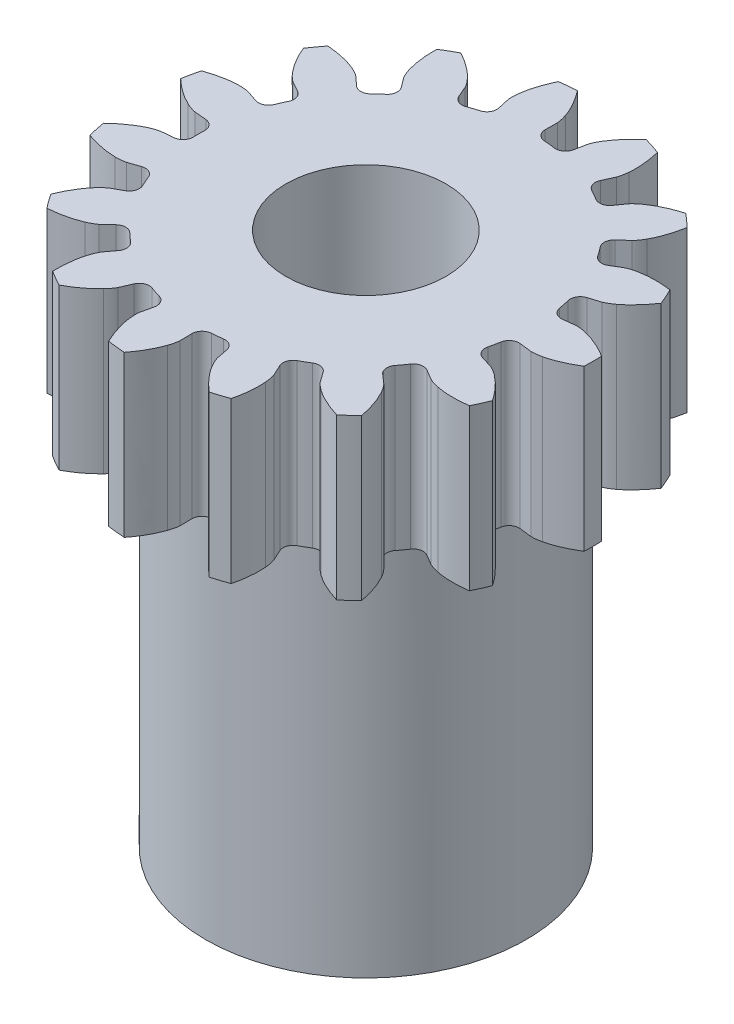
from build123d import *

# Parameters (mm, degrees)
GEAR_DEPTH          = 1.5
GEAR_DEPTH_BACK     = 1.5
SKETCH2_R           = 3
BOSS_EXTRUDE2_DEPTH = 7
CUT_EXTRUDE1_REACH  = 13.664
SKETCH3_R           = 1.5


with BuildPart() as part:
    # Sketch1 → Gear (new, two sides: drawn at the far end of the back side and taken through both)
    with BuildSketch(Plane(origin=(0, 0, 3), x_dir=(1, 0, 0), z_dir=(0, -1, 0)).offset(-GEAR_DEPTH_BACK)):
        with BuildLine():
            Line((3.283233276, -3.394638448), (3.506962679, -3.421139032))
            add(Edge.make_bspline(
                [(3.506962679, -3.421139032), (3.520971899, -3.421858666), (3.535034749, -3.421569149), (3.549044877, -3.420867398), (3.574923599, -3.419571163), (3.600737251, -3.416660714), (3.626357328, -3.412787712), (3.652179785, -3.408884116), (3.677858618, -3.40395475), (3.703347036, -3.39826459)],
                knots=[0, 0, 0, 0, 4.2083e-05, 4.2083e-05, 4.2083e-05, 0.000119856, 0.000119856, 0.000119856, 0.000198214, 0.000198214, 0.000198214, 0.000198214], degree=3))
            add(Edge.make_bspline(
                [(3.703347036, -3.39826459), (3.768488307, -3.383427383), (3.83255335, -3.363384186), (3.895049223, -3.339766527), (3.95623019, -3.31664578), (4.016141242, -3.289967313), (4.07458154, -3.260600474), (4.13359138, -3.230947433), (4.19124207, -3.198475681), (4.247452965, -3.163808703)],
                knots=[0, 0, 0, 0, 0.000200429, 0.000200429, 0.000200429, 0.00039651, 0.00039651, 0.00039651, 0.00059445, 0.00059445, 0.00059445, 0.00059445], degree=3))
            ThreePointArc((4.247452965, -3.163808703), (4.250611007, -2.999999723), (4.247452965, -2.836190743))
            add(Edge.make_bspline(
                [(4.247452965, -2.836190743), (4.190684784, -2.801180069), (4.132447355, -2.768407706), (4.072824237, -2.738516948), (4.014405475, -2.709229967), (3.954518093, -2.68263313), (3.893364025, -2.659597097), (3.831403647, -2.636257336), (3.767904147, -2.616439009), (3.703347036, -2.601734856)],
                knots=[0, 0, 0, 0, 0.000200088, 0.000200088, 0.000200088, 0.000396183, 0.000396183, 0.000396183, 0.000594989, 0.000594989, 0.000594989, 0.000594989], degree=3))
            add(Edge.make_bspline(
                [(3.703347036, -2.601734856), (3.67599376, -2.595628375), (3.648419071, -2.590394931), (3.620682813, -2.586371148), (3.601932002, -2.583650912), (3.583086418, -2.581476669), (3.564191122, -2.580076536), (3.545162836, -2.578666549), (3.526018009, -2.577881568), (3.506962679, -2.578860413)],
                knots=[0, 0, 0, 0, 8.408e-05, 8.408e-05, 8.408e-05, 0.000140907, 0.000140907, 0.000140907, 0.000198175, 0.000198175, 0.000198175, 0.000198175], degree=3))
            Line((3.506962679, -2.578860413), (3.28323342, -2.60536098))
            ThreePointArc((3.28323342, -2.60536098), (3.149457375, -2.56974365), (3.076583394, -2.452040481))
            ThreePointArc((3.076583394, -2.452040481), (3.056711251, -2.350275945), (3.033473976, -2.24922669))
            ThreePointArc((3.033473976, -2.24922669), (3.052173215, -2.112058995), (3.159896814, -2.025109088))
            Line((3.159896814, -2.025109088), (3.375062772, -1.958319562))
            add(Edge.make_bspline(
                [(3.375062772, -1.958319562), (3.388153533, -1.953278917), (3.400882829, -1.947294553), (3.413396289, -1.94095504), (3.436510452, -1.929245046), (3.45890861, -1.91608686), (3.480738424, -1.902128072), (3.502740676, -1.88805902), (3.524194504, -1.873111299), (3.545164935, -1.857546005)],
                knots=[0, 0, 0, 0, 4.2083e-05, 4.2083e-05, 4.2083e-05, 0.000119856, 0.000119856, 0.000119856, 0.000198214, 0.000198214, 0.000198214, 0.000198214], degree=3))
            add(Edge.make_bspline(
                [(3.545164935, -1.857546005), (3.598639612, -1.8174962), (3.649013638, -1.773128228), (3.696500292, -1.726133061), (3.742987831, -1.680126667), (3.786868191, -1.631386654), (3.828311489, -1.580788901), (3.870158683, -1.529698036), (3.909617758, -1.476584967), (3.946868635, -1.422052075)],
                knots=[0, 0, 0, 0, 0.000200429, 0.000200429, 0.000200429, 0.00039651, 0.00039651, 0.00039651, 0.00059445, 0.00059445, 0.00059445, 0.00059445], degree=3))
            ThreePointArc((3.946868635, -1.422052075), (3.883126535, -1.271120634), (3.813614406, -1.122758176))
            add(Edge.make_bspline(
                [(3.813614406, -1.122758176), (3.747513968, -1.113864033), (3.680981708, -1.107612287), (3.614355613, -1.104556627), (3.54907533, -1.10156269), (3.483547577, -1.101623663), (3.418310956, -1.1054528), (3.352214199, -1.109332423), (3.286143679, -1.117055054), (3.221187105, -1.129879885)],
                knots=[0, 0, 0, 0, 0.000200088, 0.000200088, 0.000200088, 0.000396183, 0.000396183, 0.000396183, 0.000594989, 0.000594989, 0.000594989, 0.000594989], degree=3))
            add(Edge.make_bspline(
                [(3.221187105, -1.129879885), (3.193714915, -1.135426917), (3.166395549, -1.141861564), (3.139420597, -1.149467008), (3.121184459, -1.15460859), (3.103083817, -1.16028751), (3.08525262, -1.166693835), (3.067295922, -1.173145248), (3.049486972, -1.180215035), (3.032477194, -1.188859756)],
                knots=[0, 0, 0, 0, 8.408e-05, 8.408e-05, 8.408e-05, 0.000140907, 0.000140907, 0.000140907, 0.000198175, 0.000198175, 0.000198175, 0.000198175], degree=3))
            Line((3.032477194, -1.188859756), (2.838868973, -1.30406819))
            ThreePointArc((2.838868973, -1.30406819), (2.702171593, -1.325941758), (2.587723707, -1.248055071))
            ThreePointArc((2.587723707, -1.248055071), (2.528178169, -1.163171167), (2.465849356, -1.080309431))
            ThreePointArc((2.465849356, -1.080309431), (2.427140833, -0.947394841), (2.490185524, -0.824147013))
            Line((2.490185524, -0.824147013), (2.65958366, -0.675615865))
            add(Edge.make_bspline(
                [(2.65958366, -0.675615865), (2.669492451, -0.665686515), (2.67868718, -0.655042056), (2.687540283, -0.644160939), (2.703893238, -0.62406195), (2.719003057, -0.602931197), (2.733268034, -0.581300225), (2.747645693, -0.559498385), (2.761164953, -0.537116903), (2.77399142, -0.514367857)],
                knots=[0, 0, 0, 0, 4.2083e-05, 4.2083e-05, 4.2083e-05, 0.000119856, 0.000119856, 0.000119856, 0.000198214, 0.000198214, 0.000198214, 0.000198214], degree=3))
            add(Edge.make_bspline(
                [(2.77399142, -0.514367857), (2.806553245, -0.456030429), (2.834526128, -0.395009308), (2.858792688, -0.332762524), (2.882548683, -0.271825406), (2.902811037, -0.209451439), (2.920091414, -0.146371583), (2.9375402, -0.082676969), (2.951984827, -0.018106313), (2.963834671, 0.046863258)],
                knots=[0, 0, 0, 0, 0.000200429, 0.000200429, 0.000200429, 0.00039651, 0.00039651, 0.00039651, 0.00059445, 0.00059445, 0.00059445, 0.00059445], degree=3))
            ThreePointArc((2.963834671, 0.046863258), (2.844214018, 0.158819743), (2.72036708, 0.266082462))
            add(Edge.make_bspline(
                [(2.72036708, 0.266082462), (2.656363751, 0.247322196), (2.593040693, 0.225972343), (2.530931878, 0.201664552), (2.470077628, 0.177847767), (2.410239846, 0.151139527), (2.352200678, 0.121107312), (2.293396271, 0.090679127), (2.236178925, 0.056750851), (2.18205447, 0.018614566)],
                knots=[0, 0, 0, 0, 0.000200088, 0.000200088, 0.000200088, 0.000396183, 0.000396183, 0.000396183, 0.000594989, 0.000594989, 0.000594989, 0.000594989], degree=3))
            add(Edge.make_bspline(
                [(2.18205447, 0.018614566), (2.159213557, 0.002373154), (2.136873281, -0.014616976), (2.115323849, -0.032536596), (2.100755578, -0.04465097), (2.086529644, -0.057201116), (2.072845721, -0.070306186), (2.059065488, -0.083503493), (2.045671744, -0.097205617), (2.033648663, -0.112021462)],
                knots=[0, 0, 0, 0, 8.408e-05, 8.408e-05, 8.408e-05, 0.000140907, 0.000140907, 0.000140907, 0.000198175, 0.000198175, 0.000198175, 0.000198175], degree=3))
            Line((2.033648663, -0.112021462), (1.903638244, -0.296017163))
            ThreePointArc((1.903638244, -0.296017163), (1.787655755, -0.371599494), (1.651423038, -0.346996614))
            ThreePointArc((1.651423038, -0.346996614), (1.562500089, -0.293670661), (1.47185698, -0.243324111))
            ThreePointArc((1.47185698, -0.243324111), (1.382433751, -0.137644766), (1.389898535, 0.000590313))
            Line((1.389898535, 0.000590313), (1.484238372, 0.205180698))
            add(Edge.make_bspline(
                [(1.484238372, 0.205180698), (1.489251871, 0.218281879), (1.493322184, 0.23174591), (1.496984147, 0.245287186), (1.503748319, 0.270299872), (1.508957174, 0.295749492), (1.51319077, 0.321312457), (1.517457807, 0.347077351), (1.520704898, 0.37302263), (1.523169588, 0.399021911)],
                knots=[0, 0, 0, 0, 4.2083e-05, 4.2083e-05, 4.2083e-05, 0.000119856, 0.000119856, 0.000119856, 0.000198214, 0.000198214, 0.000198214, 0.000198214], degree=3))
            add(Edge.make_bspline(
                [(1.523169588, 0.399021911), (1.529188326, 0.465559892), (1.5299233, 0.532683056), (1.526773858, 0.599418422), (1.52369068, 0.664749682), (1.516831483, 0.729972579), (1.506961004, 0.794627457), (1.49699433, 0.859912444), (1.483926902, 0.924775832), (1.468326768, 0.988948255)],
                knots=[0, 0, 0, 0, 0.000200429, 0.000200429, 0.000200429, 0.00039651, 0.00039651, 0.00039651, 0.00059445, 0.00059445, 0.00059445, 0.00059445], degree=3))
            ThreePointArc((1.468326768, 0.988948255), (1.313511059, 1.042571489), (1.156743572, 1.090187772))
            add(Edge.make_bspline(
                [(1.156743572, 1.090187772), (1.10590411, 1.047016917), (1.056739386, 1.001757047), (1.009887028, 0.954288845), (0.963981064, 0.907779475), (0.920179751, 0.859042065), (0.879373534, 0.807999615), (0.838029293, 0.756284178), (0.799558519, 0.702016764), (0.765624794, 0.645163136)],
                knots=[0, 0, 0, 0, 0.000200088, 0.000200088, 0.000200088, 0.000396183, 0.000396183, 0.000396183, 0.000594989, 0.000594989, 0.000594989, 0.000594989], degree=3))
            add(Edge.make_bspline(
                [(0.765624794, 0.645163136), (0.751364559, 0.621035631), (0.73786621, 0.596427766), (0.72546839, 0.571292435), (0.717086973, 0.554299954), (0.709195539, 0.537048616), (0.702024966, 0.519510786), (0.694803925, 0.501849521), (0.688141287, 0.483884281), (0.683183803, 0.465459105)],
                knots=[0, 0, 0, 0, 8.408e-05, 8.408e-05, 8.408e-05, 0.000140907, 0.000140907, 0.000140907, 0.000198175, 0.000198175, 0.000198175, 0.000198175], degree=3))
            Line((0.683183803, 0.465459105), (0.639251168, 0.244490667))
            ThreePointArc((0.639251168, 0.244490667), (0.564037996, 0.128268444), (0.429576324, 0.095333455))
            ThreePointArc((0.429576324, 0.095333455), (0.326651548, 0.107880915), (0.223367162, 0.117006903))
            ThreePointArc((0.223367162, 0.117006903), (0.098691314, 0.177178085), (0.049285462, 0.306498315))
            Line((0.049285462, 0.306498315), (0.052254785, 0.5317724))
            add(Edge.make_bspline(
                [(0.052254785, 0.5317724), (0.051506114, 0.545780099), (0.049748215, 0.559735648), (0.047585851, 0.573595674), (0.043591655, 0.599197137), (0.037998888, 0.624565154), (0.031469075, 0.649640043), (0.024887681, 0.674913005), (0.017301151, 0.699935907), (0.008977896, 0.724689913)],
                knots=[0, 0, 0, 0, 4.2083e-05, 4.2083e-05, 4.2083e-05, 0.000119856, 0.000119856, 0.000119856, 0.000198214, 0.000198214, 0.000198214, 0.000198214], degree=3))
            add(Edge.make_bspline(
                [(0.008977896, 0.724689913), (-0.012587148, 0.787923423), (-0.039217166, 0.849542426), (-0.069238043, 0.909227223), (-0.098627284, 0.967656258), (-0.131422014, 1.024450452), (-0.166736654, 1.079500937), (-0.20239546, 1.135087928), (-0.240715466, 1.18902858), (-0.281068174, 1.241307859)],
                knots=[0, 0, 0, 0, 0.000200429, 0.000200429, 0.000200429, 0.00039651, 0.00039651, 0.00039651, 0.00059445, 0.00059445, 0.00059445, 0.00059445], degree=3))
            ThreePointArc((-0.281068174, 1.241307859), (-0.444309896, 1.2273259), (-0.606891408, 1.207062457))
            add(Edge.make_bspline(
                [(-0.606891408, 1.207062457), (-0.635776399, 1.146945647), (-0.662281762, 1.085601603), (-0.685776463, 1.023180672), (-0.708796583, 0.962020611), (-0.728987784, 0.899681172), (-0.745505283, 0.836454191), (-0.762240563, 0.77239357), (-0.775312818, 0.707170347), (-0.783188364, 0.641429884)],
                knots=[0, 0, 0, 0, 0.000200088, 0.000200088, 0.000200088, 0.000396183, 0.000396183, 0.000396183, 0.000594989, 0.000594989, 0.000594989, 0.000594989], degree=3))
            add(Edge.make_bspline(
                [(-0.783188364, 0.641429884), (-0.786402197, 0.613588151), (-0.788724633, 0.585617475), (-0.789827144, 0.55761256), (-0.790572485, 0.538680126), (-0.790764917, 0.519710509), (-0.790182283, 0.50077237), (-0.789595549, 0.481700939), (-0.78837505, 0.462578936), (-0.785409743, 0.443730311)],
                knots=[0, 0, 0, 0, 8.408e-05, 8.408e-05, 8.408e-05, 0.000140907, 0.000140907, 0.000140907, 0.000198175, 0.000198175, 0.000198175, 0.000198175], degree=3))
            Line((-0.785409743, 0.443730311), (-0.735668241, 0.223996586))
            ThreePointArc((-0.735668241, 0.223996586), (-0.757107056, 0.087230348), (-0.866548039, 0.00245225))
            ThreePointArc((-0.866548039, 0.00245225), (-0.965678108, -0.027948384), (-1.063745058, -0.061620961))
            ThreePointArc((-1.063745058, -0.061620961), (-1.202115943, -0.057362093), (-1.299849716, 0.040682647))
            Line((-1.299849716, 0.040682647), (-1.388764239, 0.247688286))
            add(Edge.make_bspline(
                [(-1.388764239, 0.247688286), (-1.395145628, 0.260180444), (-1.402427783, 0.27221447), (-1.41004058, 0.283996721), (-1.424102514, 0.305760235), (-1.439529863, 0.326660289), (-1.455694019, 0.346911425), (-1.471985861, 0.367322531), (-1.489094234, 0.38709637), (-1.506766266, 0.406324907)],
                knots=[0, 0, 0, 0, 4.2083e-05, 4.2083e-05, 4.2083e-05, 0.000119856, 0.000119856, 0.000119856, 0.000198214, 0.000198214, 0.000198214, 0.000198214], degree=3))
            add(Edge.make_bspline(
                [(-1.506766266, 0.406324907), (-1.5521863, 0.4553203), (-1.601576738, 0.500780655), (-1.653278168, 0.543094839), (-1.703891805, 0.584518738), (-1.756951562, 0.623063997), (-1.811604139, 0.65899136), (-1.866789346, 0.69526886), (-1.923736053, 0.728959947), (-1.981863985, 0.76030652)],
                knots=[0, 0, 0, 0, 0.000200429, 0.000200429, 0.000200429, 0.00039651, 0.00039651, 0.00039651, 0.00059445, 0.00059445, 0.00059445, 0.00059445], degree=3))
            ThreePointArc((-1.981863985, 0.76030652), (-2.125305684, 0.681137114), (-2.26558935, 0.596497824))
            add(Edge.make_bspline(
                [(-2.26558935, 0.596497824), (-2.267525393, 0.5298298), (-2.266788377, 0.463008526), (-2.262862974, 0.396428012), (-2.259016862, 0.33119239), (-2.252106708, 0.266029977), (-2.241479463, 0.201550983), (-2.2307121, 0.136221842), (-2.216125525, 0.071320499), (-2.196581139, 0.008060323)],
                knots=[0, 0, 0, 0, 0.000200088, 0.000200088, 0.000200088, 0.000396183, 0.000396183, 0.000396183, 0.000594989, 0.000594989, 0.000594989, 0.000594989], degree=3))
            add(Edge.make_bspline(
                [(-2.196581139, 0.008060323), (-2.188192869, -0.018681549), (-2.17893782, -0.045178652), (-2.168554389, -0.071210847), (-2.161534778, -0.088809644), (-2.153994935, -0.10621752), (-2.145759838, -0.123281393), (-2.137466779, -0.140465366), (-2.128574179, -0.157437762), (-2.11819881, -0.17345074)],
                knots=[0, 0, 0, 0, 8.408e-05, 8.408e-05, 8.408e-05, 0.000140907, 0.000140907, 0.000140907, 0.000198175, 0.000198175, 0.000198175, 0.000198175], degree=3))
            Line((-2.11819881, -0.17345074), (-1.983383929, -0.353955795))
            ThreePointArc((-1.983383929, -0.353955795), (-1.94734142, -0.487617921), (-2.012838374, -0.609580226))
            ThreePointArc((-2.012838374, -0.609580226), (-2.091033147, -0.677672418), (-2.166925892, -0.74832127))
            ThreePointArc((-2.166925892, -0.74832127), (-2.295066223, -0.80071111), (-2.424228857, -0.75089469))
            Line((-2.424228857, -0.75089469), (-2.589653094, -0.597950423))
            add(Edge.make_bspline(
                [(-2.589653094, -0.597950423), (-2.600563801, -0.589133814), (-2.61211106, -0.581102103), (-2.62385797, -0.573434884), (-2.645556203, -0.559272429), (-2.668150606, -0.546454148), (-2.691154177, -0.534528369), (-2.71433946, -0.522508385), (-2.73801148, -0.511402686), (-2.761976636, -0.501024407)],
                knots=[0, 0, 0, 0, 4.2083e-05, 4.2083e-05, 4.2083e-05, 0.000119856, 0.000119856, 0.000119856, 0.000198214, 0.000198214, 0.000198214, 0.000198214], degree=3))
            add(Edge.make_bspline(
                [(-2.761976636, -0.501024407), (-2.823398123, -0.474738881), (-2.887008926, -0.45329768), (-2.951451262, -0.435670616), (-3.014537737, -0.418414422), (-3.078688006, -0.404782923), (-3.143228595, -0.39419085), (-3.208398179, -0.38349555), (-3.274124984, -0.375879523), (-3.339977292, -0.370885763)],
                knots=[0, 0, 0, 0, 0.000200429, 0.000200429, 0.000200429, 0.00039651, 0.00039651, 0.00039651, 0.00059445, 0.00059445, 0.00059445, 0.00059445], degree=3))
            ThreePointArc((-3.339977292, -0.370885763), (-3.438816706, -0.50155361), (-3.532546311, -0.635933956))
            add(Edge.make_bspline(
                [(-3.532546311, -0.635933956), (-3.507198646, -0.697625686), (-3.479346688, -0.758370186), (-3.448679919, -0.817597907), (-3.418632603, -0.875629259), (-3.385815922, -0.932347472), (-3.349881482, -0.986929474), (-3.313473251, -1.042231133), (-3.273749997, -1.095588566), (-3.23016508, -1.145430194)],
                knots=[0, 0, 0, 0, 0.000200088, 0.000200088, 0.000200088, 0.000396183, 0.000396183, 0.000396183, 0.000594989, 0.000594989, 0.000594989, 0.000594989], degree=3))
            add(Edge.make_bspline(
                [(-3.23016508, -1.145430194), (-3.211625115, -1.166448293), (-3.192392864, -1.186890234), (-3.17231888, -1.206448506), (-3.158748071, -1.219670673), (-3.144779661, -1.232506829), (-3.130316022, -1.244745937), (-3.115750585, -1.257071186), (-3.100723495, -1.268959296), (-3.084732059, -1.279367836)],
                knots=[0, 0, 0, 0, 8.408e-05, 8.408e-05, 8.408e-05, 0.000140907, 0.000140907, 0.000140907, 0.000198175, 0.000198175, 0.000198175, 0.000198175], degree=3))
            Line((-3.084732059, -1.279367836), (-2.888154516, -1.389433257))
            ThreePointArc((-2.888154516, -1.389433257), (-2.800862762, -1.496879876), (-2.811090668, -1.634937997))
            ThreePointArc((-2.811090668, -1.634937997), (-2.854829558, -1.728947989), (-2.895425554, -1.824357287))
            ThreePointArc((-2.895425554, -1.824357287), (-2.991178703, -1.924337156), (-3.129436804, -1.931362767))
            Line((-3.129436804, -1.931362767), (-3.342767402, -1.858925326))
            add(Edge.make_bspline(
                [(-3.342767402, -1.858925326), (-3.356320867, -1.855308737), (-3.370136604, -1.852668097), (-3.383986479, -1.850441643), (-3.409569191, -1.846329063), (-3.43542387, -1.843808952), (-3.461289329, -1.842270607), (-3.487359107, -1.840720109), (-3.513501668, -1.840202826), (-3.539616153, -1.840469303)],
                knots=[0, 0, 0, 0, 4.2083e-05, 4.2083e-05, 4.2083e-05, 0.000119856, 0.000119856, 0.000119856, 0.000198214, 0.000198214, 0.000198214, 0.000198214], degree=3))
            add(Edge.make_bspline(
                [(-3.539616153, -1.840469303), (-3.606418761, -1.84143865), (-3.673251043, -1.847723983), (-3.739291619, -1.857831917), (-3.803942709, -1.867727182), (-3.868091326, -1.881366452), (-3.931360272, -1.897941135), (-3.995245819, -1.914677349), (-4.058387961, -1.934453263), (-4.120578183, -1.956675783)],
                knots=[0, 0, 0, 0, 0.000200429, 0.000200429, 0.000200429, 0.00039651, 0.00039651, 0.00039651, 0.00059445, 0.00059445, 0.00059445, 0.00059445], degree=3))
            ThreePointArc((-4.120578183, -1.956675783), (-4.157725079, -2.116248413), (-4.188693923, -2.277134232))
            add(Edge.make_bspline(
                [(-4.188693923, -2.277134232), (-4.140445392, -2.323182608), (-4.090294348, -2.367347058), (-4.038188776, -2.408980975), (-3.98713571, -2.449773908), (-3.934086804, -2.488240827), (-3.879058559, -2.523488114), (-3.823304774, -2.559200132), (-3.765313352, -2.591787669), (-3.705224134, -2.619592679)],
                knots=[0, 0, 0, 0, 0.000200088, 0.000200088, 0.000200088, 0.000396183, 0.000396183, 0.000396183, 0.000594989, 0.000594989, 0.000594989, 0.000594989], degree=3))
            add(Edge.make_bspline(
                [(-3.705224134, -2.619592679), (-3.679738202, -2.631252785), (-3.65385418, -2.642104966), (-3.627560617, -2.651807511), (-3.609785126, -2.658366817), (-3.591803413, -2.664411765), (-3.573612129, -2.669709854), (-3.555292809, -2.675045233), (-3.536729549, -2.679793493), (-3.517887111, -2.682797864)],
                knots=[0, 0, 0, 0, 8.408e-05, 8.408e-05, 8.408e-05, 0.000140907, 0.000140907, 0.000140907, 0.000198175, 0.000198175, 0.000198175, 0.000198175], degree=3))
            Line((-3.517887111, -2.682797864), (-3.29353695, -2.70339234))
            ThreePointArc((-3.29353695, -2.70339234), (-3.170089487, -2.766044956), (-3.123279848, -2.896327389))
            ThreePointArc((-3.123279848, -2.896327389), (-3.125000003, -3.000000199), (-3.12327982, -3.103673008))
            ThreePointArc((-3.12327982, -3.103673008), (-3.17008919, -3.233955492), (-3.293536684, -3.296608352))
            Line((-3.293536684, -3.296608352), (-3.517886845, -3.317202828))
            add(Edge.make_bspline(
                [(-3.517886845, -3.317202828), (-3.53173955, -3.319411601), (-3.545434899, -3.322618623), (-3.558992969, -3.326217908), (-3.584036677, -3.332866305), (-3.608681123, -3.341080114), (-3.632936097, -3.350195196), (-3.657382668, -3.35938228), (-3.681475484, -3.369542856), (-3.705223868, -3.380408013)],
                knots=[0, 0, 0, 0, 4.2083e-05, 4.2083e-05, 4.2083e-05, 0.000119856, 0.000119856, 0.000119856, 0.000198214, 0.000198214, 0.000198214, 0.000198214], degree=3))
            add(Edge.make_bspline(
                [(-3.705223868, -3.380408013), (-3.765856818, -3.408464623), (-3.82435467, -3.441389699), (-3.880574471, -3.477484879), (-3.935611414, -3.51282062), (-3.9886665, -3.551372306), (-4.039724028, -3.592247831), (-4.091279148, -3.633521717), (-4.140918776, -3.677270136), (-4.188693657, -3.72286646)],
                knots=[0, 0, 0, 0, 0.000200429, 0.000200429, 0.000200429, 0.00039651, 0.00039651, 0.00039651, 0.00059445, 0.00059445, 0.00059445, 0.00059445], degree=3))
            ThreePointArc((-4.188693657, -3.72286646), (-4.157724886, -3.883752414), (-4.120578053, -4.043325181))
            add(Edge.make_bspline(
                [(-4.120578053, -4.043325181), (-4.057771265, -4.06576802), (-3.993992706, -4.085715985), (-3.929457858, -4.102557215), (-3.866226581, -4.119058262), (-3.802118088, -4.132622607), (-3.737510922, -4.142440602), (-3.672051919, -4.152388046), (-3.605819573, -4.158571007), (-3.539616024, -4.159531661)],
                knots=[0, 0, 0, 0, 0.000200088, 0.000200088, 0.000200088, 0.000396183, 0.000396183, 0.000396183, 0.000594989, 0.000594989, 0.000594989, 0.000594989], degree=3))
            add(Edge.make_bspline(
                [(-3.539616024, -4.159531661), (-3.511590874, -4.159817635), (-3.483530664, -4.159203616), (-3.455563919, -4.157372776), (-3.436657289, -4.156135056), (-3.417771476, -4.154343569), (-3.398997983, -4.151784553), (-3.380092358, -4.149207525), (-3.361202685, -4.145994919), (-3.342767273, -4.141075638)],
                knots=[0, 0, 0, 0, 8.408e-05, 8.408e-05, 8.408e-05, 0.000140907, 0.000140907, 0.000140907, 0.000198175, 0.000198175, 0.000198175, 0.000198175], degree=3))
            Line((-3.342767273, -4.141075638), (-3.129436675, -4.068638197))
            ThreePointArc((-3.129436675, -4.068638197), (-2.991178708, -4.075663595), (-2.895425332, -4.175643298))
            ThreePointArc((-2.895425332, -4.175643298), (-2.85482943, -4.271052297), (-2.811090655, -4.365061997))
            ThreePointArc((-2.811090655, -4.365061997), (-2.800862496, -4.503120044), (-2.888154176, -4.610566888))
            Line((-2.888154176, -4.610566888), (-3.084731718, -4.720632309))
            add(Edge.make_bspline(
                [(-3.084731718, -4.720632309), (-3.096488406, -4.728284526), (-3.107695316, -4.736784687), (-3.118617269, -4.745587361), (-3.138791687, -4.761847168), (-3.157964651, -4.779374655), (-3.176415235, -4.797567083), (-3.195011566, -4.815903218), (-3.21288877, -4.834984798), (-3.23016474, -4.85456995)],
                knots=[0, 0, 0, 0, 4.2083e-05, 4.2083e-05, 4.2083e-05, 0.000119856, 0.000119856, 0.000119856, 0.000198214, 0.000198214, 0.000198214, 0.000198214], degree=3))
            add(Edge.make_bspline(
                [(-3.23016474, -4.85456995), (-3.274144045, -4.904862582), (-3.314192657, -4.958734356), (-3.350870769, -5.014575596), (-3.386777177, -5.069241943), (-3.419565027, -5.126040109), (-3.449582826, -5.184148726), (-3.479893169, -5.242823654), (-3.507447141, -5.302980079), (-3.532545971, -5.364066188)],
                knots=[0, 0, 0, 0, 0.000200429, 0.000200429, 0.000200429, 0.00039651, 0.00039651, 0.00039651, 0.00059445, 0.00059445, 0.00059445, 0.00059445], degree=3))
            ThreePointArc((-3.532545971, -5.364066188), (-3.438816522, -5.498446643), (-3.339977259, -5.629114605))
            add(Edge.make_bspline(
                [(-3.339977259, -5.629114605), (-3.273472079, -5.624071336), (-3.207093897, -5.616353632), (-3.141288434, -5.605490174), (-3.076812208, -5.594846152), (-3.01272907, -5.581162526), (-2.949714148, -5.563853609), (-2.885868383, -5.546316476), (-2.822847288, -5.52502577), (-2.761976603, -5.498975961)],
                knots=[0, 0, 0, 0, 0.000200088, 0.000200088, 0.000200088, 0.000396183, 0.000396183, 0.000396183, 0.000594989, 0.000594989, 0.000594989, 0.000594989], degree=3))
            add(Edge.make_bspline(
                [(-2.761976603, -5.498975961), (-2.736258039, -5.487838356), (-2.710873505, -5.475864306), (-2.686069282, -5.462816651), (-2.669300642, -5.453995918), (-2.652776256, -5.444677761), (-2.636666663, -5.434704116), (-2.620443687, -5.424660274), (-2.604493796, -5.41404229), (-2.589653061, -5.402049946)],
                knots=[0, 0, 0, 0, 8.408e-05, 8.408e-05, 8.408e-05, 0.000140907, 0.000140907, 0.000140907, 0.000198175, 0.000198175, 0.000198175, 0.000198175], degree=3))
            Line((-2.589653061, -5.402049946), (-2.424228824, -5.249105679))
            ThreePointArc((-2.424228824, -5.249105679), (-2.295066381, -5.199289118), (-2.166925903, -5.25167874))
            ThreePointArc((-2.166925903, -5.25167874), (-2.091033147, -5.322327582), (-2.012838365, -5.390419763))
            ThreePointArc((-2.012838365, -5.390419763), (-1.94734121, -5.512381898), (-1.983383559, -5.646044199))
            Line((-1.983383559, -5.646044199), (-2.11819844, -5.826549254))
            add(Edge.make_bspline(
                [(-2.11819844, -5.826549254), (-2.125826271, -5.838321778), (-2.132606967, -5.850645322), (-2.139004297, -5.863129324), (-2.150821086, -5.886189072), (-2.161207389, -5.909999575), (-2.170663309, -5.934123714), (-2.180193924, -5.958438415), (-2.188764385, -5.98314162), (-2.19658077, -6.008060317)],
                knots=[0, 0, 0, 0, 4.2083e-05, 4.2083e-05, 4.2083e-05, 0.000119856, 0.000119856, 0.000119856, 0.000198214, 0.000198214, 0.000198214, 0.000198214], degree=3))
            add(Edge.make_bspline(
                [(-2.19658077, -6.008060317), (-2.216302008, -6.071892917), (-2.230976611, -6.137396469), (-2.241771055, -6.203328313), (-2.252338385, -6.267872958), (-2.25918968, -6.333096684), (-2.2629774, -6.398390886), (-2.266802034, -6.464321427), (-2.267506017, -6.530484266), (-2.26558898, -6.596497818)],
                knots=[0, 0, 0, 0, 0.000200429, 0.000200429, 0.000200429, 0.00039651, 0.00039651, 0.00039651, 0.00059445, 0.00059445, 0.00059445, 0.00059445], degree=3))
            ThreePointArc((-2.26558898, -6.596497818), (-2.125305413, -6.68113727), (-1.981863805, -6.760306844))
            add(Edge.make_bspline(
                [(-1.981863805, -6.760306844), (-1.923159582, -6.728649494), (-1.865659169, -6.694600582), (-1.809961453, -6.657910826), (-1.755388803, -6.621962185), (-1.702411576, -6.583396609), (-1.651884751, -6.541953649), (-1.600691737, -6.499964269), (-1.551778812, -6.454881252), (-1.506766086, -6.40632523)],
                knots=[0, 0, 0, 0, 0.000200088, 0.000200088, 0.000200088, 0.000396183, 0.000396183, 0.000396183, 0.000594989, 0.000594989, 0.000594989, 0.000594989], degree=3))
            add(Edge.make_bspline(
                [(-1.506766086, -6.40632523), (-1.487801081, -6.385689839), (-1.46948144, -6.36442618), (-1.452128614, -6.342417767), (-1.440397415, -6.327539207), (-1.429091673, -6.312305574), (-1.418431475, -6.296641833), (-1.407696247, -6.280867848), (-1.39744402, -6.264680432), (-1.38876406, -6.24768861)],
                knots=[0, 0, 0, 0, 8.408e-05, 8.408e-05, 8.408e-05, 0.000140907, 0.000140907, 0.000140907, 0.000198175, 0.000198175, 0.000198175, 0.000198175], degree=3))
            Line((-1.38876406, -6.24768861), (-1.299849537, -6.04068297))
            ThreePointArc((-1.299849537, -6.04068297), (-1.202115994, -5.942638179), (-1.063745063, -5.938379053))
            ThreePointArc((-1.063745063, -5.938379053), (-0.965678108, -5.972051616), (-0.866548035, -6.002452236))
            ThreePointArc((-0.866548035, -6.002452236), (-0.757106938, -6.087230098), (-0.735667906, -6.22399643))
            Line((-0.735667906, -6.22399643), (-0.785409408, -6.443730155))
            add(Edge.make_bspline(
                [(-0.785409408, -6.443730155), (-0.787589462, -6.457587409), (-0.788771499, -6.471603484), (-0.789538049, -6.485610215), (-0.790953979, -6.511482665), (-0.790757734, -6.537459132), (-0.789583976, -6.563343698), (-0.788400946, -6.589432734), (-0.786182753, -6.615486155), (-0.783188029, -6.641429728)],
                knots=[0, 0, 0, 0, 4.2083e-05, 4.2083e-05, 4.2083e-05, 0.000119856, 0.000119856, 0.000119856, 0.000198214, 0.000198214, 0.000198214, 0.000198214], degree=3))
            add(Edge.make_bspline(
                [(-0.783188029, -6.641429728), (-0.775241219, -6.707765059), (-0.762004442, -6.773574231), (-0.74504876, -6.838196463), (-0.728449824, -6.90145905), (-0.708179914, -6.963830562), (-0.685082624, -7.025020388), (-0.661760234, -7.086806554), (-0.635492503, -7.14753565), (-0.606891073, -7.207062301)],
                knots=[0, 0, 0, 0, 0.000200429, 0.000200429, 0.000200429, 0.00039651, 0.00039651, 0.00039651, 0.00059445, 0.00059445, 0.00059445, 0.00059445], degree=3))
            ThreePointArc((-0.606891073, -7.207062301), (-0.444309561, -7.227325744), (-0.281067838, -7.241307703))
            add(Edge.make_bspline(
                [(-0.281067838, -7.241307703), (-0.240315066, -7.188510116), (-0.201634765, -7.134017363), (-0.165675438, -7.077845301), (-0.130442471, -7.022807886), (-0.097731399, -6.966028701), (-0.068429218, -6.907617561), (-0.038740692, -6.848436279), (-0.012393426, -6.787356215), (0.008978231, -6.724689757)],
                knots=[0, 0, 0, 0, 0.000200088, 0.000200088, 0.000200088, 0.000396183, 0.000396183, 0.000396183, 0.000594989, 0.000594989, 0.000594989, 0.000594989], degree=3))
            add(Edge.make_bspline(
                [(0.008978231, -6.724689757), (0.017910456, -6.698124626), (0.025997571, -6.671248038), (0.032898539, -6.644084322), (0.037563867, -6.625720572), (0.041696099, -6.607205496), (0.045063658, -6.588560064), (0.048454919, -6.569783401), (0.051236779, -6.550825504), (0.05225512, -6.531772244)],
                knots=[0, 0, 0, 0, 8.408e-05, 8.408e-05, 8.408e-05, 0.000140907, 0.000140907, 0.000140907, 0.000198175, 0.000198175, 0.000198175, 0.000198175], degree=3))
            Line((0.05225512, -6.531772244), (0.049285802, -6.306498535))
            ThreePointArc((0.049285802, -6.306498535), (0.098691422, -6.177178353), (0.223367205, -6.117006915))
            ThreePointArc((0.223367205, -6.117006915), (0.326651569, -6.107880913), (0.429576322, -6.095333441))
            ThreePointArc((0.429576322, -6.095333441), (0.564038003, -6.128268167), (0.639251411, -6.244490388))
            Line((0.639251411, -6.244490388), (0.683184045, -6.465458826))
            add(Edge.make_bspline(
                [(0.683184045, -6.465458826), (0.68682872, -6.479004766), (0.691449727, -6.492289865), (0.6964465, -6.505397435), (0.705676257, -6.529609004), (0.716421116, -6.553259868), (0.728021599, -6.576429185), (0.739713718, -6.599781524), (0.752337019, -6.622680288), (0.765625037, -6.645162857)],
                knots=[0, 0, 0, 0, 4.2083e-05, 4.2083e-05, 4.2083e-05, 0.000119856, 0.000119856, 0.000119856, 0.000198214, 0.000198214, 0.000198214, 0.000198214], degree=3))
            add(Edge.make_bspline(
                [(0.765625037, -6.645162857), (0.799865819, -6.702530939), (0.838725219, -6.757266726), (0.880499235, -6.809405576), (0.92139433, -6.860447429), (0.965280593, -6.909182126), (1.011269162, -6.955687299), (1.057705923, -7.002645699), (1.106403437, -7.047440441), (1.156743815, -7.090187493)],
                knots=[0, 0, 0, 0, 0.000200429, 0.000200429, 0.000200429, 0.00039651, 0.00039651, 0.00039651, 0.00059445, 0.00059445, 0.00059445, 0.00059445], degree=3))
            ThreePointArc((1.156743815, -7.090187493), (1.313511301, -7.042571211), (1.46832701, -6.988947976))
            add(Edge.make_bspline(
                [(1.46832701, -6.988947976), (1.484081807, -6.924139334), (1.497253821, -6.858625031), (1.507257065, -6.792683323), (1.517058248, -6.728073604), (1.523847125, -6.662898445), (1.526858048, -6.597618944), (1.52990867, -6.531478741), (1.529134595, -6.464962927), (1.52316983, -6.399021633)],
                knots=[0, 0, 0, 0, 0.000200088, 0.000200088, 0.000200088, 0.000396183, 0.000396183, 0.000396183, 0.000594989, 0.000594989, 0.000594989, 0.000594989], degree=3))
            add(Edge.make_bspline(
                [(1.52316983, -6.399021633), (1.520524812, -6.371120115), (1.516981066, -6.343277804), (1.512236935, -6.315655638), (1.509029715, -6.296981958), (1.505273937, -6.278386865), (1.500766574, -6.259983705), (1.496227488, -6.24145102), (1.491057972, -6.223000635), (1.484238615, -6.205180419)],
                knots=[0, 0, 0, 0, 8.408e-05, 8.408e-05, 8.408e-05, 0.000140907, 0.000140907, 0.000140907, 0.000198175, 0.000198175, 0.000198175, 0.000198175], degree=3))
            Line((1.484238615, -6.205180419), (1.389898935, -6.000590375))
            ThreePointArc((1.389898935, -6.000590375), (1.382433958, -5.862355435), (1.471857025, -5.756675882))
            ThreePointArc((1.471857025, -5.756675882), (1.562500107, -5.706329328), (1.651423031, -5.653003373))
            ThreePointArc((1.651423031, -5.653003373), (1.787655648, -5.62840025), (1.903638352, -5.703982484))
            Line((1.903638352, -5.703982484), (2.033648771, -5.887978184))
            add(Edge.make_bspline(
                [(2.033648771, -5.887978184), (2.042487977, -5.898870593), (2.052113014, -5.909127602), (2.062009122, -5.919069593), (2.080288657, -5.937433881), (2.099724247, -5.954669692), (2.119745626, -5.971117576), (2.13992516, -5.987695385), (2.160770885, -6.003480088), (2.182054579, -6.018614213)],
                knots=[0, 0, 0, 0, 4.2083e-05, 4.2083e-05, 4.2083e-05, 0.000119856, 0.000119856, 0.000119856, 0.000198214, 0.000198214, 0.000198214, 0.000198214], degree=3))
            add(Edge.make_bspline(
                [(2.182054579, -6.018614213), (2.236668791, -6.057095583), (2.294431669, -6.091293671), (2.353800912, -6.121933857), (2.411921033, -6.151929377), (2.471835316, -6.178600587), (2.532763323, -6.20237994), (2.594285117, -6.226391041), (2.656992172, -6.24750601), (2.720367188, -6.266082109)],
                knots=[0, 0, 0, 0, 0.000200429, 0.000200429, 0.000200429, 0.00039651, 0.00039651, 0.00039651, 0.00059445, 0.00059445, 0.00059445, 0.00059445], degree=3))
            ThreePointArc((2.720367188, -6.266082109), (2.844214126, -6.158819389), (2.96383478, -6.046862905))
            add(Edge.make_bspline(
                [(2.96383478, -6.046862905), (2.951867454, -5.981249211), (2.937253619, -5.916041376), (2.919571128, -5.851731943), (2.902245815, -5.788721528), (2.881938637, -5.726419772), (2.858137687, -5.665559328), (2.834022924, -5.603896446), (2.806261353, -5.543446071), (2.773991528, -5.485631789)],
                knots=[0, 0, 0, 0, 0.000200088, 0.000200088, 0.000200088, 0.000396183, 0.000396183, 0.000396183, 0.000594989, 0.000594989, 0.000594989, 0.000594989], degree=3))
            add(Edge.make_bspline(
                [(2.773991528, -5.485631789), (2.760226614, -5.461218311), (2.745664753, -5.437224465), (2.730095827, -5.413919973), (2.719570615, -5.398165211), (2.708576235, -5.382705361), (2.696973316, -5.367726547), (2.685288732, -5.352642309), (2.673061697, -5.337889676), (2.659583769, -5.324383781)],
                knots=[0, 0, 0, 0, 8.408e-05, 8.408e-05, 8.408e-05, 0.000140907, 0.000140907, 0.000140907, 0.000198175, 0.000198175, 0.000198175, 0.000198175], degree=3))
            Line((2.659583769, -5.324383781), (2.490185915, -5.175852881))
            ThreePointArc((2.490185915, -5.175852881), (2.427141103, -5.052605258), (2.465849393, -4.919690544))
            ThreePointArc((2.465849393, -4.919690544), (2.528178181, -4.836828816), (2.587723694, -4.751944921))
            ThreePointArc((2.587723694, -4.751944921), (2.702171391, -4.674058052), (2.838868928, -4.695931443))
            Line((2.838868928, -4.695931443), (3.032477149, -4.811139878))
            add(Edge.make_bspline(
                [(3.032477149, -4.811139878), (3.044982508, -4.817495359), (3.057947318, -4.822950748), (3.071031634, -4.828008099), (3.095200249, -4.837349754), (3.11996598, -4.845190285), (3.144946377, -4.852072745), (3.170124101, -4.859009572), (3.195587836, -4.864950895), (3.22118706, -4.870119748)],
                knots=[0, 0, 0, 0, 4.2083e-05, 4.2083e-05, 4.2083e-05, 0.000119856, 0.000119856, 0.000119856, 0.000198214, 0.000198214, 0.000198214, 0.000198214], degree=3))
            add(Edge.make_bspline(
                [(3.22118706, -4.870119748), (3.286731409, -4.883060628), (3.35341004, -4.890807856), (3.420109028, -4.894651413), (3.485404678, -4.898414101), (3.550987257, -4.898410129), (3.616319695, -4.895351996), (3.682288845, -4.89226406), (3.748162823, -4.886048287), (3.813614361, -4.877241457)],
                knots=[0, 0, 0, 0, 0.000200429, 0.000200429, 0.000200429, 0.00039651, 0.00039651, 0.00039651, 0.00059445, 0.00059445, 0.00059445, 0.00059445], degree=3))
            ThreePointArc((3.813614361, -4.877241457), (3.88312649, -4.728878999), (3.94686859, -4.577947558))
            add(Edge.make_bspline(
                [(3.94686859, -4.577947558), (3.9092484, -4.522874016), (3.869375582, -4.469247677), (3.82706482, -4.417690203), (3.785608714, -4.367174164), (3.741716776, -4.318518352), (3.695219354, -4.272600288), (3.648108868, -4.226076799), (3.598160028, -4.182144283), (3.54516489, -4.142453628)],
                knots=[0, 0, 0, 0, 0.000200088, 0.000200088, 0.000200088, 0.000396183, 0.000396183, 0.000396183, 0.000594989, 0.000594989, 0.000594989, 0.000594989], degree=3))
            add(Edge.make_bspline(
                [(3.54516489, -4.142453628), (3.522660159, -4.125749501), (3.49959806, -4.109752875), (3.475896348, -4.094795615), (3.45987305, -4.084683913), (3.443541096, -4.075032454), (3.42684887, -4.066067959), (3.410039159, -4.057040371), (3.39286877, -4.048536353), (3.375062727, -4.041680071)],
                knots=[0, 0, 0, 0, 8.408e-05, 8.408e-05, 8.408e-05, 0.000140907, 0.000140907, 0.000140907, 0.000198175, 0.000198175, 0.000198175, 0.000198175], degree=3))
            Line((3.375062727, -4.041680071), (3.159896895, -3.974890584))
            ThreePointArc((3.159896895, -3.974890584), (3.052173113, -3.887940791), (3.03347404, -3.750772998))
            ThreePointArc((3.03347404, -3.750772998), (3.056711282, -3.649723774), (3.07658341, -3.547959274))
            ThreePointArc((3.07658341, -3.547959274), (3.149457145, -3.430255998), (3.283233276, -3.394638448))
        make_face()
    extrude(amount=GEAR_DEPTH + GEAR_DEPTH_BACK)

    # Sketch2 → Boss-Extrude2 (add)
    with BuildSketch(Plane(origin=(0, -1.5, 0), x_dir=(-1, 0, 0), z_dir=(0, -1, 0))):
        Circle(SKETCH2_R)
    extrude(amount=BOSS_EXTRUDE2_DEPTH)

    # Sketch3 → Cut-Extrude1 (cut, up to next)
    with BuildSketch(Plane.XZ.offset(8.5), mode=Mode.PRIVATE) as cut_extrude1_sk1:
        Circle(SKETCH3_R)
    cut_extrude1_tool1 = extrude(cut_extrude1_sk1.sketch, amount=-CUT_EXTRUDE1_REACH, mode=Mode.PRIVATE) & part.part
    add(cut_extrude1_tool1.solids().sort_by_distance((0, -8.5, 0))[0], mode=Mode.SUBTRACT)


solid = part.part
